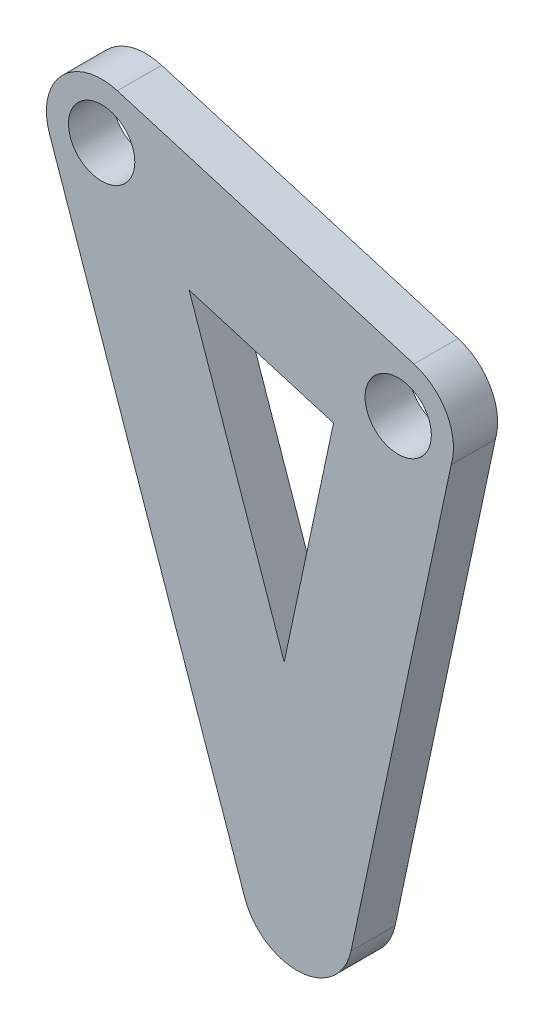
from build123d import *

# Parameters (mm, degrees)
BOSS_EXTRU_1_DEPTH      = 2
ESQUISSE2_R             = 1.5
ENL_V_MAT_EXTRU_1_DEPTH = 2


with BuildPart() as part:
    # Esquisse1 → Boss.-Extru.1 (new body)
    with BuildSketch(Plane.XY):
        with BuildLine():
            Line((-36.939711753, -10.835982903), (-28.105322833, -36.349774711))
            ThreePointArc((-28.105322833, -36.349774711), (-25.588682721, -38.027012465), (-23.297783694, -36.052579486))
            Line((-23.297783694, -36.052579486), (-18.763886374, -14.728100955))
            ThreePointArc((-18.763886374, -14.728100955), (-18.961021654, -12.824866099), (-20.44620762, -11.61847152))
            Line((-20.44620762, -11.61847152), (-33.863669528, -7.622008589))
            ThreePointArc((-33.863669528, -7.622008589), (-36.383421268, -8.289397427), (-36.939711753, -10.835982903))
        make_face()
        Polygon((-24.085912758, -15.751447914), (-26.31791891, -26.23061998), (-30.620361937, -13.805127209), align=None, mode=Mode.SUBTRACT)
    extrude(amount=-BOSS_EXTRU_1_DEPTH)

    # Esquisse2 → Enlèv. mat.-Extru.1 (cut)
    with BuildSketch(Plane.XY):
        with Locations((-34.577323623, -10.017983929)):
            Circle(ESQUISSE2_R)
        with Locations((-21.159861715, -14.01444686)):
            Circle(ESQUISSE2_R)
    extrude(amount=-ENL_V_MAT_EXTRU_1_DEPTH, mode=Mode.SUBTRACT)


solid = part.part
